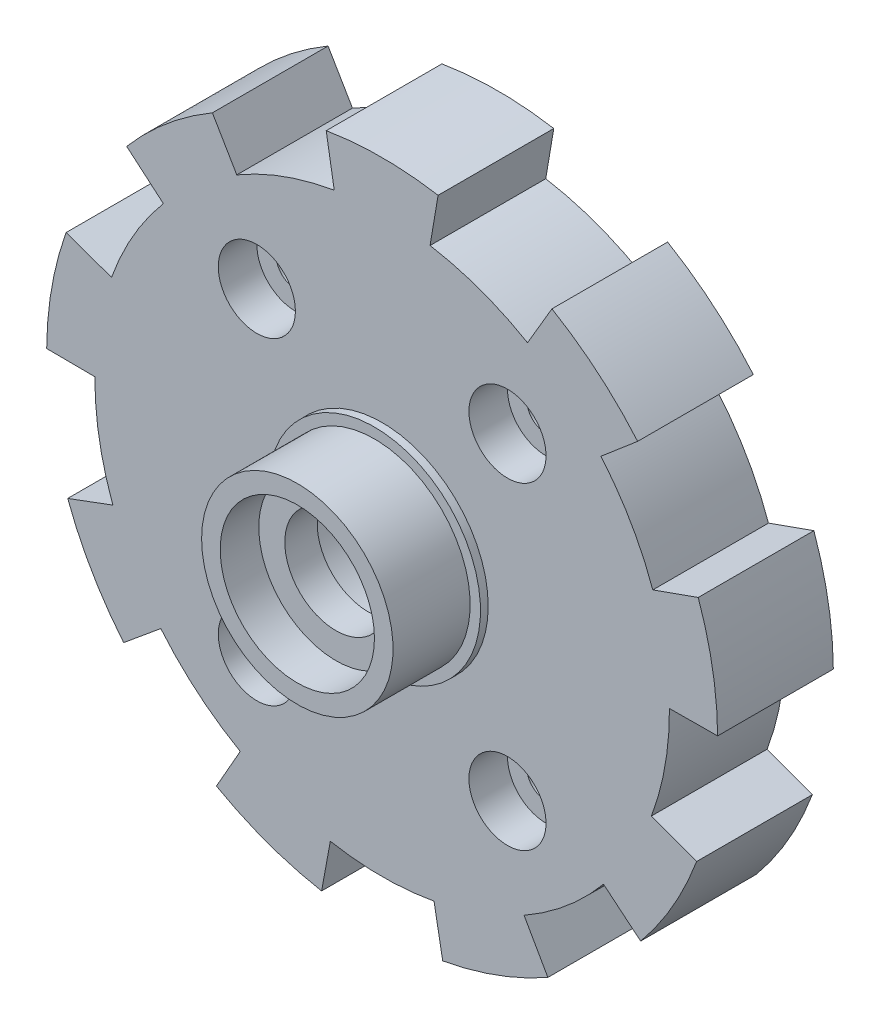
from build123d import *

# Parameters (mm, degrees)
ESQUISSE1_R               = 1
BOSS_EXTRU_2_DEPTH        = 6
ESQUISSE5_R               = 2
ENL_V_MAT_EXTRU_1_DEPTH   = 2
SYM_TRIE2_COPY_1_SKETCH_R = 2
SYM_TRIE2_COPY_1_DEPTH    = 2


with BuildPart() as part:
    # Esquisse1 → Boss.-Extru.2 (new body)
    with BuildSketch(Plane.XY):
        with BuildLine():
            Line((-8.804987496, 15.007737844), (-7.539903085, 12.851453671))
            ThreePointArc((-7.539903085, 12.851453671), (-5.096100136, 14.00142005), (-2.484854326, 14.691340952))
            Line((-2.484854326, 14.691340952), (-2.901776193, 17.156331045))
            ThreePointArc((-2.901776193, 17.156331045), (0, 17.4), (2.901776193, 17.156331045))
            Line((2.901776193, 17.156331045), (2.484854326, 14.691340952))
            ThreePointArc((2.484854326, 14.691340952), (5.096100136, 14.00142005), (7.539903085, 12.851453671))
            Line((7.539903085, 12.851453671), (8.804987496, 15.007737844))
            ThreePointArc((8.804987496, 15.007737844), (11.184504409, 13.32917331), (13.250766551, 11.277286278))
            Line((13.250766551, 11.277286278), (11.346920782, 9.656986526))
            ThreePointArc((11.346920782, 9.656986526), (12.903778516, 7.45), (14.036656047, 4.998228389))
            Line((14.036656047, 4.998228389), (16.391799678, 5.836857314))
            ThreePointArc((16.391799678, 5.836857314), (17.135654902, 3.021478291), (17.399575974, 0.121473929))
            Line((17.399575974, 0.121473929), (14.899636898, 0.104020778))
            ThreePointArc((14.899636898, 0.104020778), (14.67363552, -2.587357847), (13.965501643, -5.193723505))
            Line((13.965501643, -5.193723505), (16.308706617, -6.065153623))
            ThreePointArc((16.308706617, -6.065153623), (15.068842026, -8.7), (13.406930424, -11.091177422))
            Line((13.406930424, -11.091177422), (11.480647317, -9.497617447))
            ThreePointArc((11.480647317, -9.497617447), (9.577535384, -11.414062202), (7.359733812, -12.95547445))
            Line((7.359733812, -12.95547445), (8.594588479, -15.129211773))
            ThreePointArc((8.594588479, -15.129211773), (5.951150494, -16.350651602), (3.141033127, -17.114143592))
            Line((3.141033127, -17.114143592), (2.689735264, -14.655214915))
            ThreePointArc((2.689735264, -14.655214915), (0, -14.9), (-2.689735264, -14.655214915))
            Line((-2.689735264, -14.655214915), (-3.141033127, -17.114143592))
            ThreePointArc((-3.141033127, -17.114143592), (-5.951150494, -16.350651602), (-8.594588479, -15.129211773))
            Line((-8.594588479, -15.129211773), (-7.359733812, -12.95547445))
            ThreePointArc((-7.359733812, -12.95547445), (-9.577535384, -11.414062202), (-11.480647317, -9.497617447))
            Line((-11.480647317, -9.497617447), (-13.406930424, -11.091177422))
            ThreePointArc((-13.406930424, -11.091177422), (-15.068842026, -8.7), (-16.308706617, -6.065153623))
            Line((-16.308706617, -6.065153623), (-13.965501643, -5.193723505))
            ThreePointArc((-13.965501643, -5.193723505), (-14.67363552, -2.587357847), (-14.899636898, 0.104020778))
            Line((-14.899636898, 0.104020778), (-17.399575974, 0.121473929))
            ThreePointArc((-17.399575974, 0.121473929), (-17.135654902, 3.021478291), (-16.391799678, 5.836857314))
            Line((-16.391799678, 5.836857314), (-14.036656047, 4.998228389))
            ThreePointArc((-14.036656047, 4.998228389), (-12.903778516, 7.45), (-11.346920782, 9.656986526))
            Line((-11.346920782, 9.656986526), (-13.250766551, 11.277286278))
            ThreePointArc((-13.250766551, 11.277286278), (-11.184504409, 13.32917331), (-8.804987496, 15.007737844))
        make_face()
        with Locations((-6.5, -8.25)):
            Circle(ESQUISSE1_R, mode=Mode.SUBTRACT)
        with Locations((-6.5, 8.25)):
            Circle(ESQUISSE1_R, mode=Mode.SUBTRACT)
        with Locations((6.5, -8.25)):
            Circle(ESQUISSE1_R, mode=Mode.SUBTRACT)
        with Locations((6.5, 8.25)):
            Circle(ESQUISSE1_R, mode=Mode.SUBTRACT)
    extrude(amount=BOSS_EXTRU_2_DEPTH)

    # Esquisse3 → Révolution1 (revolve)
    with BuildSketch(Plane(origin=(0, 0, 0), x_dir=(1, 0, 0), z_dir=(0, 1, 0))):
        Polygon((0, -6), (-5.5, -6), (-5.5, -6.4), (-4.965, -6.4), (-4.965, -10.4), (0, -10.4), align=None)
    revolve(axis=Axis((0, 0, -3.652866049), (0, 0, 1)))

    # Esquisse4 → Enlèvement de matière-Révolution1 (revolve, cut)
    with BuildSketch(Plane(origin=(0, 0, 0), x_dir=(1, 0, 0), z_dir=(0, 1, 0)), mode=Mode.PRIVATE) as enl_vement_de_mati_re_r_volution1_sk:
        Polygon((-2.65, -6.72), (-2.65, -8.4), (-4, -8.4), (-4, -10.4), (0, -10.4), (0, 0), (-12.6, 0), (-12.6, -2.5), (-8, -2.5), (-8, -4.72), (-4, -4.72), (-4, -6.72), align=None)
    revolve(enl_vement_de_mati_re_r_volution1_sk.sketch.rotate(Axis((0, 0, 13.157502932), (0, 0, -1)), 180), axis=Axis((0, 0, 13.157502932), (0, 0, -1)), mode=Mode.SUBTRACT)

    # Esquisse5 → Enlèv. mat.-Extru.1 (cut)
    with BuildSketch(Plane.XY.offset(6)):
        with Locations((-6.5, 8.25)):
            Circle(ESQUISSE5_R)
    enl_v_mat_extru_1 = extrude(amount=-ENL_V_MAT_EXTRU_1_DEPTH, mode=Mode.SUBTRACT)

    # Symétrie1: Enlèv. mat.-Extru.1 across plane
    add(enl_v_mat_extru_1.mirror(Plane.ZX), mode=Mode.SUBTRACT)

    # Symétrie2: Enlèv. mat.-Extru.1 across plane
    add(enl_v_mat_extru_1.mirror(Plane(origin=(0, 0, 0), x_dir=(0, 0, 1), z_dir=(1, 0, 0))), mode=Mode.SUBTRACT)

    # Symétrie2 copy 1 sketch → Symétrie2 copy 1 (cut)
    with BuildSketch(Plane(origin=(0, 0, 6), x_dir=(-1, 0, 0), z_dir=(0, 0, 1))):
        with Locations((-6.5, 8.25)):
            Circle(SYM_TRIE2_COPY_1_SKETCH_R)
    extrude(amount=-SYM_TRIE2_COPY_1_DEPTH, mode=Mode.SUBTRACT)


solid = part.part
